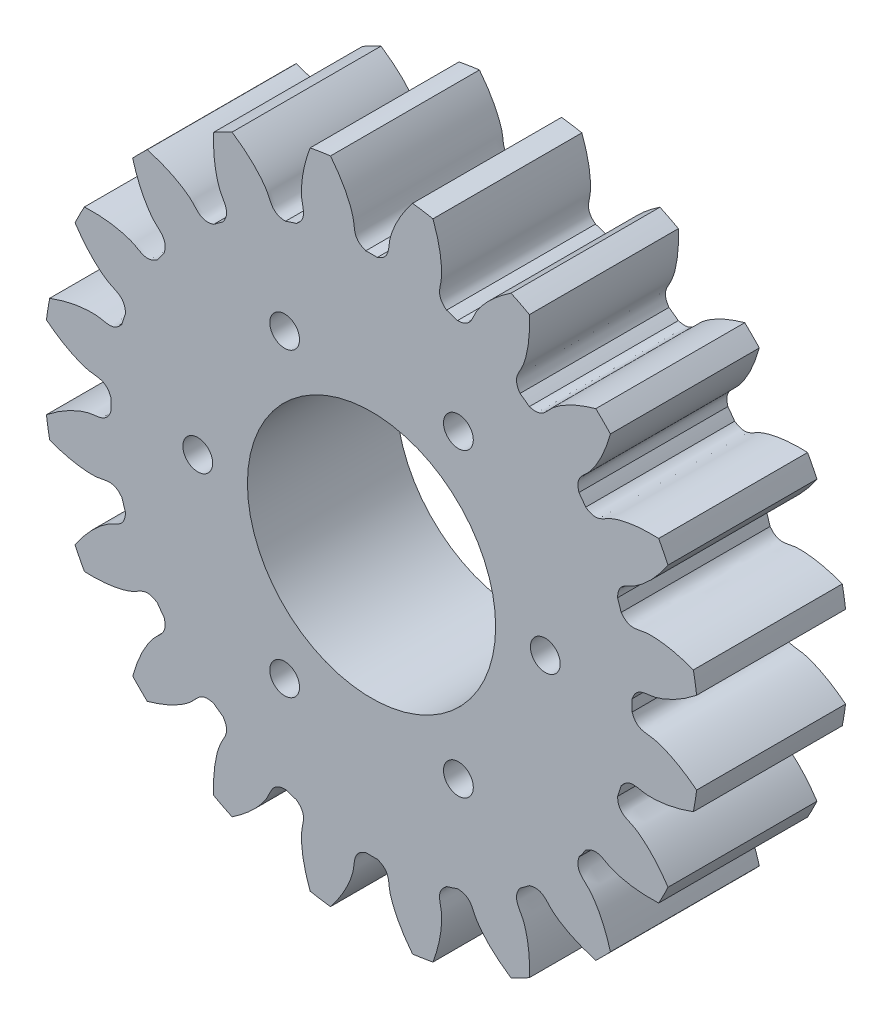
from build123d import *

# Parameters (mm, degrees)
SKETCH_1_R               = 66
EXTRUDE_1_DEPTH          = 30
CUT_EXTRUDE_1_DEPTH      = 99.04080783
PATTERN_CIRCULAR_1_COUNT = 20
SKETCH_4_R               = 3
CUT_EXTRUDE_3_DEPTH      = 100
SKETCH_5_R               = 25
CUT_EXTRUDE_4_DEPTH      = 50


with BuildPart() as part:
    # 草图1 → 凸台-拉伸1 (new body)
    with BuildSketch(Plane.XY):
        Circle(SKETCH_1_R)
    extrude(amount=EXTRUDE_1_DEPTH)

    # 草图2 → 切除-拉伸1 (cut, through all)
    with BuildSketch(Plane.XY):
        with BuildLine():
            ThreePointArc((1.159899603, 52.487185416), (0, 52.5), (-1.159899603, 52.487185416))
            add(Edge.make_bspline(
                [(-1.159899603, 52.487185416), (-3.667136429, 53.360853072), (-3.342504596, 55.122682193), (-3.677382338, 56.820056415), (-3.713353118, 56.985339684), (-3.757865339, 57.171807691), (-3.811752582, 57.379181016), (-3.875874841, 57.607148981), (-3.95107233, 57.855376968), (-4.038179229, 58.123504398), (-4.138018499, 58.411145682), (-4.251402599, 58.717890271), (-4.379132391, 59.043303003), (-4.521996613, 59.386924384), (-4.680771188, 59.748270908), (-4.856218588, 60.126835389), (-5.049087201, 60.522087305), (-5.260110701, 60.933473168), (-5.49000743, 61.360416899), (-5.739479794, 61.802320224), (-6.009213656, 62.258563085), (-6.299877757, 62.728504067), (-6.612123129, 63.211480832), (-6.946582534, 63.706810582), (-7.303869906, 64.213790522), (-7.684579804, 64.731698343), (-8.089286883, 65.259792724), (-8.51854537, 65.797313836), (-8.972888558, 66.343483869), (-9.452828311, 66.897507567), (-9.958854579, 67.458572777), (-10.491434933, 68.02585101), (-11.051014106, 68.598498015), (-11.638013557, 69.175654361), (-12.252831039, 69.756446037), (-12.895840191, 70.339985054), (-13.567390137, 70.925370065), (-14.26780511, 71.511686996), (-14.99738407, 72.098009677), (-15.756400406, 72.68340049), (-16.545101397, 73.266911041), (-17.648841545, 74.049839206), (-18.503594475, 74.617995606), (-19.086947891, 74.989511158)],
                knots=[0, 0, 0, 0, 0.165916003, 0.170905922, 0.176663519, 0.183188797, 0.190481754, 0.198542391, 0.207370708, 0.216966704, 0.22733038, 0.238461736, 0.250360771, 0.263027487, 0.276461881, 0.290663956, 0.30563371, 0.321371144, 0.337876258, 0.355149051, 0.373189524, 0.391997677, 0.411573509, 0.431917021, 0.453028213, 0.474907084, 0.497553636, 0.520967867, 0.545149777, 0.570099367, 0.595816637, 0.622301587, 0.649554216, 0.677574526, 0.706362514, 0.735918183, 0.766241531, 0.797332559, 0.829191267, 0.861817654, 0.895211721, 0.929373468, 1, 1, 1, 1], degree=3))
            ThreePointArc((-19.086947891, 74.989511158), (0, 77.380477922), (19.086947891, 74.989511158))
            add(Edge.make_bspline(
                [(1.159899603, 52.487185416), (3.667136429, 53.360853072), (3.342504596, 55.122682193), (3.677382338, 56.820056415), (3.713353118, 56.985339684), (3.757865339, 57.171807691), (3.811752582, 57.379181016), (3.875874841, 57.607148981), (3.95107233, 57.855376968), (4.038179229, 58.123504398), (4.138018499, 58.411145682), (4.251402599, 58.717890271), (4.379132391, 59.043303003), (4.521996613, 59.386924384), (4.680771188, 59.748270908), (4.856218588, 60.126835389), (5.049087201, 60.522087305), (5.260110701, 60.933473168), (5.49000743, 61.360416899), (5.739479794, 61.802320224), (6.009213656, 62.258563085), (6.299877757, 62.728504067), (6.612123129, 63.211480832), (6.946582534, 63.706810582), (7.303869906, 64.213790522), (7.684579804, 64.731698343), (8.089286883, 65.259792724), (8.51854537, 65.797313836), (8.972888558, 66.343483869), (9.452828311, 66.897507567), (9.958854579, 67.458572777), (10.491434933, 68.02585101), (11.051014106, 68.598498015), (11.638013557, 69.175654361), (12.252831039, 69.756446037), (12.895840191, 70.339985054), (13.567390137, 70.925370065), (14.26780511, 71.511686996), (14.99738407, 72.098009677), (15.756400406, 72.68340049), (16.545101397, 73.266911041), (17.648841545, 74.049839206), (18.503594475, 74.617995606), (19.086947891, 74.989511158)],
                knots=[0, 0, 0, 0, 0.165916003, 0.170905922, 0.176663519, 0.183188797, 0.190481754, 0.198542391, 0.207370708, 0.216966704, 0.22733038, 0.238461736, 0.250360771, 0.263027487, 0.276461881, 0.290663956, 0.30563371, 0.321371144, 0.337876258, 0.355149051, 0.373189524, 0.391997677, 0.411573509, 0.431917021, 0.453028213, 0.474907084, 0.497553636, 0.520967867, 0.545149777, 0.570099367, 0.595816637, 0.622301587, 0.649554216, 0.677574526, 0.706362514, 0.735918183, 0.766241531, 0.797332559, 0.829191267, 0.861817654, 0.895211721, 0.929373468, 1, 1, 1, 1], degree=3))
        make_face()
    cut_extrude_1 = extrude(amount=CUT_EXTRUDE_1_DEPTH, mode=Mode.SUBTRACT)

    # 阵列(圆周)1: 切除-拉伸1 ×20 about axis
    pattern_circular_1_axis = Axis((0, 0, -1.5), (0, 0, 1))
    for i in range(1, PATTERN_CIRCULAR_1_COUNT):
        add(cut_extrude_1.rotate(pattern_circular_1_axis, i * 360 / PATTERN_CIRCULAR_1_COUNT), mode=Mode.SUBTRACT)

    # 草图4 → 切除-拉伸3 (cut)
    with BuildSketch(Plane.XY.offset(30)):
        with Locations((-35, 0)):
            Circle(SKETCH_4_R)
        with Locations((-17.5, 30.310889132)):
            Circle(SKETCH_4_R)
        with Locations((17.5, 30.310889132)):
            Circle(SKETCH_4_R)
        with Locations((35, 0)):
            Circle(SKETCH_4_R)
        with Locations((17.5, -30.310889132)):
            Circle(SKETCH_4_R)
        with Locations((-17.5, -30.310889132)):
            Circle(SKETCH_4_R)
    extrude(amount=-CUT_EXTRUDE_3_DEPTH, mode=Mode.SUBTRACT)

    # 草图5 → 切除-拉伸4 (cut)
    with BuildSketch(Plane.XY.offset(30)):
        Circle(SKETCH_5_R)
    extrude(amount=-CUT_EXTRUDE_4_DEPTH, mode=Mode.SUBTRACT)


solid = part.part
